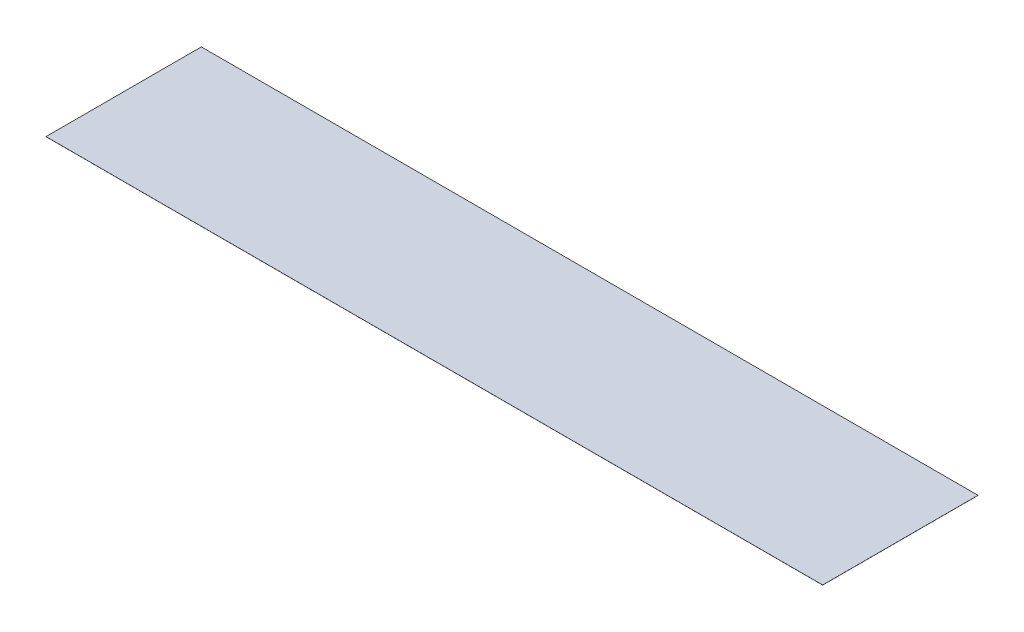
from build123d import *

# Parameters (mm, degrees)
SKETCH_1_W      = 1500
SKETCH_1_H      = 300
EXTRUDE_1_DEPTH = 0.2


with BuildPart() as part:
    # 草图1 → 凸台-拉伸1 (new body)
    with BuildSketch(Plane(origin=(0, 0, 0), x_dir=(1, 0, 0), z_dir=(0, 1, 0))):
        Rectangle(SKETCH_1_W, SKETCH_1_H)
    extrude(amount=EXTRUDE_1_DEPTH)


solid = part.part
